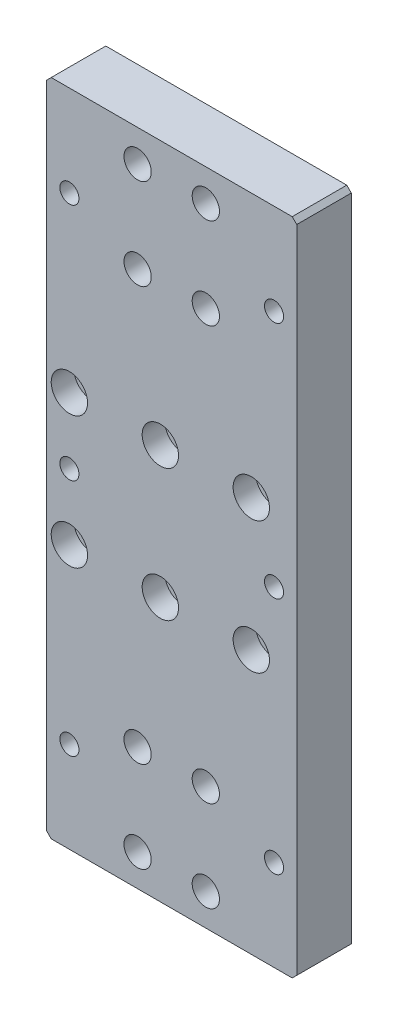
from build123d import *

# Parameters (mm, degrees)
SKETCH_1_W                   = 55
SKETCH_1_H                   = 145
EXTRUDE_1_DEPTH              = 12
HOLE_WIZARD_M3_1_D           = 3.5
HOLE_WIZARD_M3_1_CBORE_D     = 6
HOLE_WIZARD_M3_1_CBORE_DEPTH = 5
HOLE_WIZARD_1_D              = 4.5
HOLE_WIZARD_1_CBORE_D        = 8
HOLE_WIZARD_1_CBORE_DEPTH    = 5
HOLE_WIZARD_M5_1_D           = 4.2
HOLE_WIZARD_M5_1_DEPTH       = 14
HOLE_WIZARD_M5_1_TIP         = 1.2618073
HOLE_WIZARD_M3_1_2_D         = 2.5
HOLE_WIZARD_M3_1_2_DEPTH     = 8.5
HOLE_WIZARD_M3_1_2_TIP       = 0.751075774
CHAMFER_1_SIZE               = 1


with BuildPart() as part:
    # 草图1 → 凸台-拉伸1 (new body)
    with BuildSketch(Plane.XY):
        with Locations((-24.869961125, -27.624351889)):
            Rectangle(SKETCH_1_W, SKETCH_1_H)
    extrude(amount=EXTRUDE_1_DEPTH)

    # Hole Wizard M3 _1 (through all)
    with Locations(Plane.XY.offset(12)):
        with Locations((-32.369961125, 37.875648111), (-17.369961125, 37.875648111), (-17.369961125, 17.875648111), (-32.369961125, 17.875648111)):
            hole_wizard_m3_1 = CounterBoreHole(HOLE_WIZARD_M3_1_D / 2, HOLE_WIZARD_M3_1_CBORE_D / 2, HOLE_WIZARD_M3_1_CBORE_DEPTH)

    # 镜向1: Hole Wizard M3 _1 across plane
    add(hole_wizard_m3_1.mirror(Plane.ZX.offset(-27.624351889)), mode=Mode.SUBTRACT)

    # 打孔尺寸(%根据)内六角圆柱头螺钉的类型1 (through all)
    with Locations(Plane(origin=(27.369961125, 27.624351889, 12), x_dir=(1, 0, 0), z_dir=(0, 0, 1))):
        with Locations((-74.73992225, -40.748703777), (-54.73992225, -40.748703777), (-34.73992225, -40.748703777), (-34.73992225, -69.748703777), (-54.73992225, -69.748703777), (-74.73992225, -69.748703777)):
            CounterBoreHole(HOLE_WIZARD_1_D / 2, HOLE_WIZARD_1_CBORE_D / 2, HOLE_WIZARD_1_CBORE_DEPTH)

    # M5 螺纹孔1
    with Locations(Plane.XY.offset(12)):
        with Locations((-47.369961125, 24.875648111), (-2.369961125, 24.875648111), (-2.369961125, -27.624351889), (-47.369961125, -27.624351889), (-47.369961125, -80.124351889), (-2.369961125, -80.124351889)):
            Hole(HOLE_WIZARD_M5_1_D / 2, depth=HOLE_WIZARD_M5_1_DEPTH)
            with Locations((0, 0, -(HOLE_WIZARD_M5_1_DEPTH + HOLE_WIZARD_M5_1_TIP / 2))):  # 118° drill point
                Cone(0, HOLE_WIZARD_M5_1_D / 2, HOLE_WIZARD_M5_1_TIP, mode=Mode.SUBTRACT)

    # Hole Wizard M3 _1 2
    with Locations(Plane(origin=(0, 0, 0), x_dir=(-1, 0, 0), z_dir=(0, 0, -1))):
        with Locations((29.369961125, -61.124351889), (20.369961125, -61.124351889)):
            Hole(HOLE_WIZARD_M3_1_2_D / 2, depth=HOLE_WIZARD_M3_1_2_DEPTH)
            with Locations((0, 0, -(HOLE_WIZARD_M3_1_2_DEPTH + HOLE_WIZARD_M3_1_2_TIP / 2))):  # 118° drill point
                Cone(0, HOLE_WIZARD_M3_1_2_D / 2, HOLE_WIZARD_M3_1_2_TIP, mode=Mode.SUBTRACT)

    # 倒角1
    chamfer_1_edges = [part.edges().sort_by_distance(p)[0] for p in [
        (-52.369961125, 44.875648111, 6),
        (2.630038875, 44.875648111, 6),
        (2.630038875, -100.124351889, 6),
        (-52.369961125, -100.124351889, 6),
    ]]
    chamfer(chamfer_1_edges, length=CHAMFER_1_SIZE)


solid = part.part
